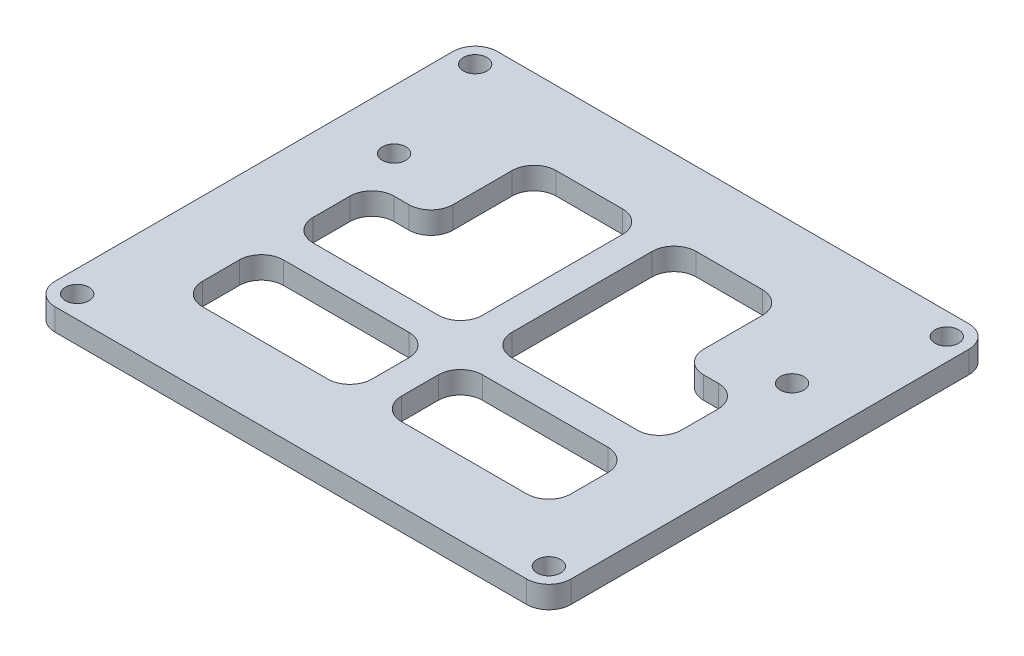
from build123d import *

# Parameters (mm, degrees)
SKETCH_1_R          = 1.6
EXTRUDE_1_DEPTH     = 3
CUT_EXTRUDE_START   = -3
SKETCH_2_R          = 1.6
CUT_EXTRUDE_1_DEPTH = 3
CUT_EXTRUDE_2_DEPTH = 3


with BuildPart() as part:
    # 草图1 → 凸台-拉伸1 (new body)
    with BuildSketch(Plane(origin=(0, 0, 0), x_dir=(1, 0, 0), z_dir=(0, 1, 0))):
        with BuildLine():
            Line((-32, 30), (32, 30))
            ThreePointArc((32, 30), (34.121320344, 29.121320344), (35, 27))
            Line((35, 27), (35, -27))
            ThreePointArc((35, -27), (34.121320344, -29.121320344), (32, -30))
            Line((32, -30), (-32, -30))
            ThreePointArc((-32, -30), (-34.121320344, -29.121320344), (-35, -27))
            Line((-35, -27), (-35, 27))
            ThreePointArc((-35, 27), (-34.121320344, 29.121320344), (-32, 30))
        make_face()
        with Locations(Location((-32, 27, 0), (0, 0, 270))):
            Circle(SKETCH_1_R, mode=Mode.SUBTRACT)
        with Locations(Location((32, 27, 0), (0, 0, 270))):
            Circle(SKETCH_1_R, mode=Mode.SUBTRACT)
        with Locations(Location((-32, -27, 0), (0, 0, 270))):
            Circle(SKETCH_1_R, mode=Mode.SUBTRACT)
        with Locations(Location((32, -27, 0), (0, 0, 270))):
            Circle(SKETCH_1_R, mode=Mode.SUBTRACT)
    extrude(amount=EXTRUDE_1_DEPTH)

    # 草图2 → 切除-拉伸1 (cut)
    with BuildSketch(Plane(origin=(0, 3, 0), x_dir=(1, 0, 0), z_dir=(0, 1, 0)).offset(CUT_EXTRUDE_START)):
        with Locations(Location((-27, 11, 0), (0, 0, 270))):
            Circle(SKETCH_2_R)
        with Locations(Location((27, 11, 0), (0, 0, 90))):
            Circle(SKETCH_2_R)
        with Locations(Location((-32, 27, 0), (0, 0, 270))):
            Circle(SKETCH_2_R)
    extrude(amount=CUT_EXTRUDE_1_DEPTH, mode=Mode.SUBTRACT)

    # 草图3 → 切除-拉伸2 (cut)
    with BuildSketch(Plane.XZ):
        with BuildLine():
            Line((-22, 20), (-5, 20))
            ThreePointArc((-5, 20), (-2.878679656, 19.121320344), (-2, 17))
            Line((-2, 17), (-2, 12))
            ThreePointArc((-2, 12), (-2.878679656, 9.878679656), (-5, 9))
            Line((-5, 9), (-22, 9))
            ThreePointArc((-22, 9), (-24.121320344, 9.878679656), (-25, 12))
            Line((-25, 12), (-25, 17))
            ThreePointArc((-25, 17), (-24.121320344, 19.121320344), (-22, 20))
        make_face()
        with BuildLine():
            Line((-22, -6), (-20, -6))
            ThreePointArc((-20, -6), (-17.878679656, -6.878679656), (-17, -9))
            Line((-17, -9), (-17, -17))
            ThreePointArc((-17, -17), (-16.121320344, -19.121320344), (-14, -20))
            Line((-14, -20), (-5, -20))
            ThreePointArc((-5, -20), (-2.878679656, -19.121320344), (-2, -17))
            Line((-2, -17), (-2, 2))
            ThreePointArc((-2, 2), (-2.878679656, 4.121320344), (-5, 5))
            Line((-5, 5), (-22, 5))
            ThreePointArc((-22, 5), (-24.121320344, 4.121320344), (-25, 2))
            Line((-25, 2), (-25, -3))
            ThreePointArc((-25, -3), (-24.121320344, -5.121320344), (-22, -6))
        make_face()
        with BuildLine():
            Line((25, 17), (25, 12))
            ThreePointArc((25, 12), (24.121320344, 9.878679656), (22, 9))
            Line((22, 9), (5, 9))
            ThreePointArc((5, 9), (2.878679656, 9.878679656), (2, 12))
            Line((2, 12), (2, 17))
            ThreePointArc((2, 17), (2.878679656, 19.121320344), (5, 20))
            Line((5, 20), (22, 20))
            ThreePointArc((22, 20), (24.121320344, 19.121320344), (25, 17))
        make_face()
        with BuildLine():
            Line((17, -9), (17, -17))
            ThreePointArc((17, -17), (16.121320344, -19.121320344), (14, -20))
            Line((14, -20), (4.999263136, -19.997789228))
            ThreePointArc((4.999263136, -19.997789228), (2.878419152, -19.118849125), (2, -16.997789318))
            Line((2, -16.997789318), (2, 2))
            ThreePointArc((2, 2), (2.878679656, 4.121320344), (5, 5))
            Line((5, 5), (22, 5))
            ThreePointArc((22, 5), (24.121320344, 4.121320344), (25, 2))
            Line((25, 2), (25, -3))
            ThreePointArc((25, -3), (24.121320344, -5.121320344), (22, -6))
            Line((22, -6), (20, -6))
            ThreePointArc((20, -6), (17.878679656, -6.878679656), (17, -9))
        make_face()
    extrude(amount=-CUT_EXTRUDE_2_DEPTH, mode=Mode.SUBTRACT)


solid = part.part
